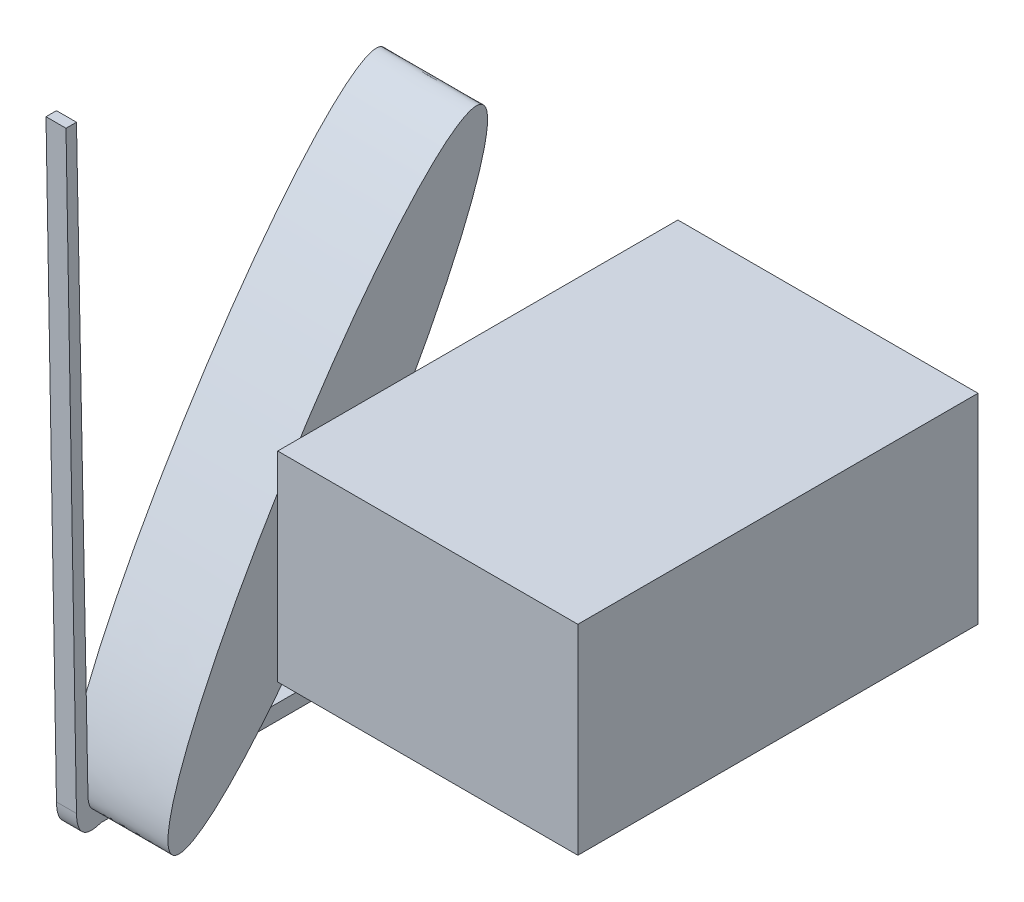
from build123d import *

# Parameters (mm, degrees)
SKETCH_1_W      = 30
SKETCH_1_H      = 20
EXTRUDE_1_DEPTH = 40
SKETCH_2_R      = 2
EXTRUDE_2_DEPTH = 5
SKETCH_3_RX     = 29.20442212
SKETCH_3_RY     = 5
EXTRUDE_4_DEPTH = 10
EXTRUDE_5_DEPTH = 2


with BuildPart() as part:
    # 草图1 → 凸台-拉伸1 (new body)
    with BuildSketch(Plane.XY):
        with Locations((15, 10)):
            Rectangle(SKETCH_1_W, SKETCH_1_H)
    extrude(amount=EXTRUDE_1_DEPTH)

    # 草图2 → 凸台-拉伸2 (add)
    with BuildSketch(Plane.ZY):
        with Locations(Location((30, 10, 0), (0, 0, 180))):
            Circle(SKETCH_2_R)
    extrude(amount=EXTRUDE_2_DEPTH)

    # 草图3 → 凸台-拉伸4 (add)
    with BuildSketch(Plane.ZY.offset(5)):
        with Locations(Location((30, 10), (0, 0, -58.183129666))):
            Ellipse(SKETCH_3_RX, SKETCH_3_RY)
    extrude(amount=EXTRUDE_4_DEPTH)

    # 草图4 → 凸台-拉伸5 (add)
    with BuildSketch(Plane.ZY.offset(15)):
        with BuildLine():
            add(Edge.make_bspline(
                [(44.671665843, -16.341862431), (45.731147297, -16.721716463), (46.343386543, -16.341862431)],
                knots=[6.044161849, 6.044161849, 6.044161849, 6.283185307, 6.283185307, 6.283185307], degree=2, weights=[1, 0.99286697, 1]))
            Line((46.343386543, -16.341862431), (44.671665843, -16.341862431))
        make_face()
        with BuildLine():
            Line((44.671665843, -16.341862431), (46.343386543, -16.341862431))
            add(Edge.make_bspline(
                [(46.343386543, -16.341862431), (47.091960208, -15.877421892), (47.119167153, -14.320823946)],
                knots=[0, 0, 0, 0.29156576, 0.29156576, 0.29156576], degree=2, weights=[1, 0.989392482, 1]))
            add(Edge.make_bspline(
                [(47.119167153, -14.320823946), (47.153377166, -12.363557646), (46.056833567, -8.932081728)],
                knots=[0.29156576, 0.29156576, 0.29156576, 0.656688827, 0.656688827, 0.656688827], degree=2, weights=[1, 0.983381875, 1]))
            Line((46.056833567, -8.932081728), (45.971258289, -13.31870573))
            add(Edge.make_bspline(
                [(45.396747079, -14.816092575), (45.948727857, -14.473624944), (45.971258289, -13.31870573)],
                knots=[3.141592654, 3.141592654, 3.141592654, 3.399981292, 3.399981292, 3.399981292], degree=2, weights=[1, 0.991666016, 1]))
            add(Edge.make_bspline(
                [(44.16063068, -14.816092575), (44.945440411, -15.096098568), (45.396747079, -14.816092575)],
                knots=[2.929941094, 2.929941094, 2.929941094, 3.141592654, 3.141592654, 3.141592654], degree=2, weights=[1, 0.994405676, 1]))
            Line((44.16063068, -14.816092575), (42.129626505, -14.816092575))
            add(Edge.make_bspline(
                [(42.129626505, -14.816092575), (43.598799221, -15.957209438), (44.671665843, -16.341862431)],
                knots=[5.802147853, 5.802147853, 5.802147853, 6.044161849, 6.044161849, 6.044161849], degree=2, weights=[1, 0.992687583, 1]))
        make_face()
        with BuildLine():
            Line((0, -16.341862431), (44.671665843, -16.341862431))
            add(Edge.make_bspline(
                [(42.129626505, -14.816092575), (43.598799221, -15.957209438), (44.671665843, -16.341862431)],
                knots=[5.802147853, 5.802147853, 5.802147853, 6.044161849, 6.044161849, 6.044161849], degree=2, weights=[1, 0.992687583, 1]))
            Line((42.129626505, -14.816092575), (0, -14.816092575))
            Line((0, -14.816092575), (0, -16.341862431))
        make_face()
        with BuildLine():
            add(Edge.make_bspline(
                [(47.119167153, -14.320823946), (47.153377166, -12.363557646), (46.056833567, -8.932081728)],
                knots=[0.29156576, 0.29156576, 0.29156576, 0.656688827, 0.656688827, 0.656688827], degree=2, weights=[1, 0.983381875, 1]))
            Line((47.119167153, -14.320823946), (48.165155486, 45.523575701))
            Line((48.165155486, 45.523575701), (47.119167153, 45.523575701))
            Line((47.119167153, 45.523575701), (46.056833567, -8.932081728))
        make_face()
    extrude(amount=-EXTRUDE_5_DEPTH)


solid = part.part
